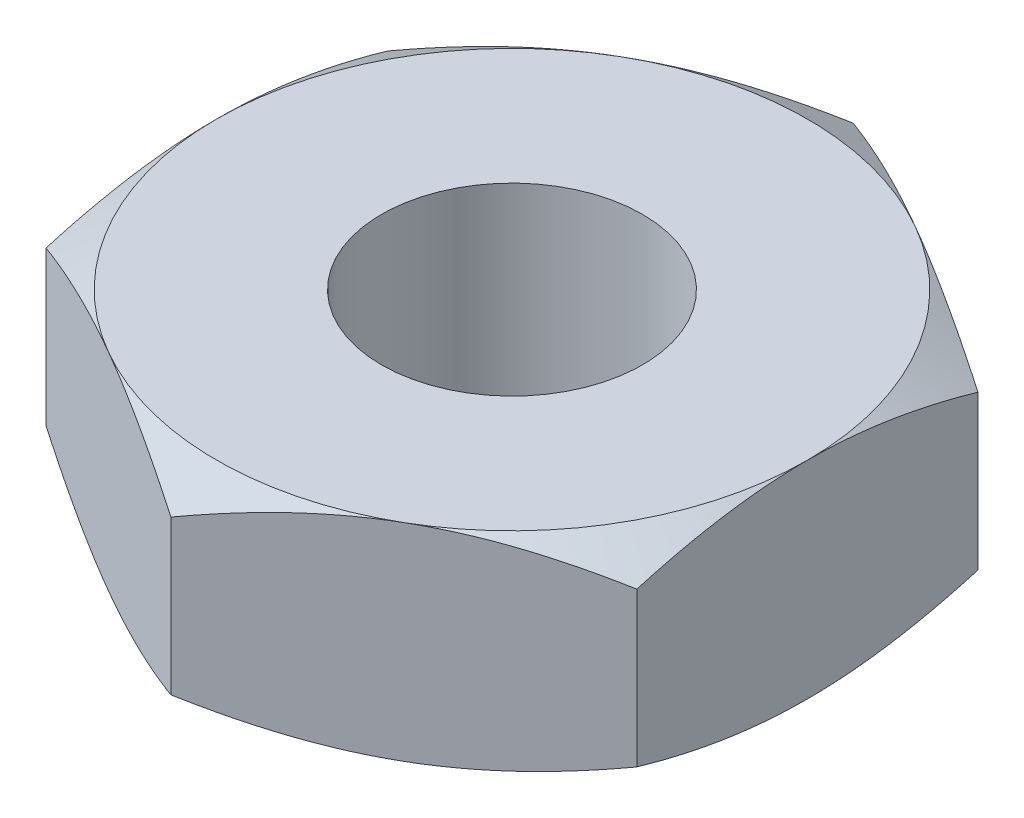
from build123d import *

# Parameters (mm, degrees)
SKETCH1_R               = 1.7526
BOSS_EXTRUDE1_DEPTH     = 1.3890625
SKETCH5_OUTSIDE_W       = 38.99
SKETCH5_OUTSIDE_H       = 40.218
SKETCH5_OUTSIDE_R       = 3.96875
CUT_EXTRUDE2_DEPTH      = 7.668602339
CUT_EXTRUDE2_DRAFT      = -60
MIRROR1_COPY_1_SKETCH_W = 38.99
MIRROR1_COPY_1_SKETCH_H = 40.218
MIRROR1_COPY_1_SKETCH_R = 3.96875
MIRROR1_COPY_1_DEPTH    = 7.668602339
MIRROR1_COPY_1_DRAFT    = -60


with BuildPart() as part:
    # Sketch1 → Boss-Extrude1 (new, symmetric)
    with BuildSketch(Plane(origin=(0, 0, 0), x_dir=(1, 0, 0), z_dir=(0, 1, 0))):
        Polygon((-3.96875, 2.291358881), (-3.96875, -2.291358881), (0, -4.582717762), (3.96875, -2.291358881), (3.96875, 2.291358881), (0, 4.582717762), align=None)
        with Locations(Location((0, 0, 0), (0, 0, 270))):
            Circle(SKETCH1_R, mode=Mode.SUBTRACT)
    extrude(amount=BOSS_EXTRUDE1_DEPTH, both=True)


with BuildPart() as cut_extrude2_tool:
    # Sketch5 outside → Cut-Extrude2 (with draft: the straight prism first)
    with BuildSketch(Plane(origin=(0, 1.3890625, 0), x_dir=(1, 0, 0), z_dir=(0, 1, 0))):
        Rectangle(SKETCH5_OUTSIDE_W, SKETCH5_OUTSIDE_H)
        Circle(SKETCH5_OUTSIDE_R, mode=Mode.SUBTRACT)
    extrude(amount=-CUT_EXTRUDE2_DEPTH)
    # Cut-Extrude2: the draft: its side faces are tilted about the plane it starts from
    cut_extrude2_sides = [cut_extrude2_tool.faces().sort_by_distance(p)[0] for p in [
        (0, -2.44523867, 20.109),
        (19.495, -2.44523867, 0),
        (0, -2.44523867, -20.109),
        (-19.495, -2.44523867, 0),
        (-3.96875, -2.44523867, 0),
    ]]
    draft(cut_extrude2_sides, Plane(origin=(0, 1.3890625, 0), x_dir=(1, 0, 0), z_dir=(0, 1, 0)), CUT_EXTRUDE2_DRAFT)


with BuildPart() as part_1:
    add(part.part)

    # Cut-Extrude2: cut by cut_extrude2_tool
    add(cut_extrude2_tool.part, mode=Mode.SUBTRACT)


with BuildPart() as mirror1_copy_1_tool:
    # Mirror1 copy 1 sketch → Mirror1 copy 1 (with draft: the straight prism first)
    with BuildSketch(Plane.XZ.offset(1.3890625)):
        Rectangle(MIRROR1_COPY_1_SKETCH_W, MIRROR1_COPY_1_SKETCH_H)
        Circle(MIRROR1_COPY_1_SKETCH_R, mode=Mode.SUBTRACT)
    extrude(amount=-MIRROR1_COPY_1_DEPTH)
    # Mirror1 copy 1: the draft: its side faces are tilted about the plane it starts from
    mirror1_copy_1_sides = [mirror1_copy_1_tool.faces().sort_by_distance(p)[0] for p in [
        (0, 2.44523867, 20.109),
        (19.495, 2.44523867, 0),
        (0, 2.44523867, -20.109),
        (-19.495, 2.44523867, 0),
        (-3.96875, 2.44523867, 0),
    ]]
    draft(mirror1_copy_1_sides, Plane.XZ.offset(1.3890625), MIRROR1_COPY_1_DRAFT)


with BuildPart() as part_2:
    add(part_1.part)

    # Mirror1 copy 1: cut by mirror1_copy_1_tool
    add(mirror1_copy_1_tool.part, mode=Mode.SUBTRACT)


solid = part_2.part
